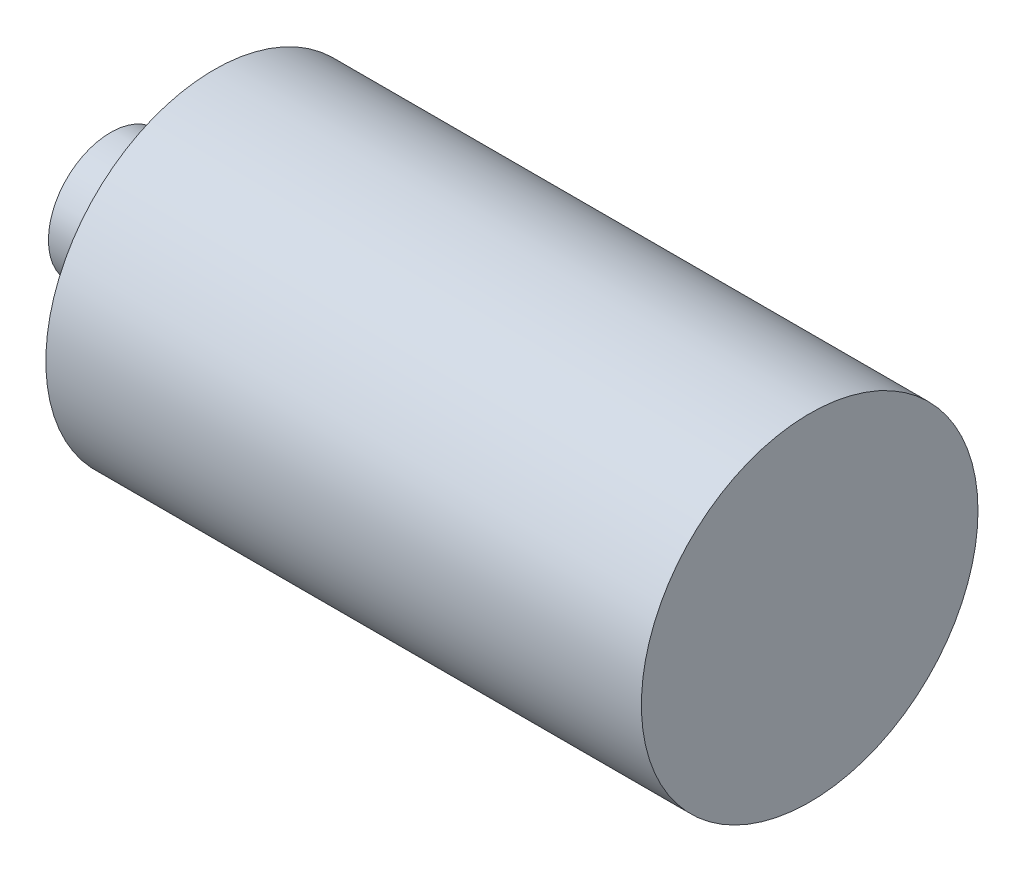
from build123d import *

# Parameters (mm, degrees)
SKETCH_1_R      = 3.25
EXTRUDE_1_DEPTH = 11.5
SKETCH_2_R      = 1.2
EXTRUDE_2_DEPTH = 2


with BuildPart() as part:
    # 草图1 → 凸台-拉伸1 (new body)
    with BuildSketch(Plane(origin=(0, 0, 0), x_dir=(0, 0, -1), z_dir=(1, 0, 0))):
        Circle(SKETCH_1_R)
    extrude(amount=EXTRUDE_1_DEPTH)

    # 草图2 → 凸台-拉伸2 (add)
    with BuildSketch(Plane.ZY):
        Circle(SKETCH_2_R)
    extrude(amount=EXTRUDE_2_DEPTH)


solid = part.part
